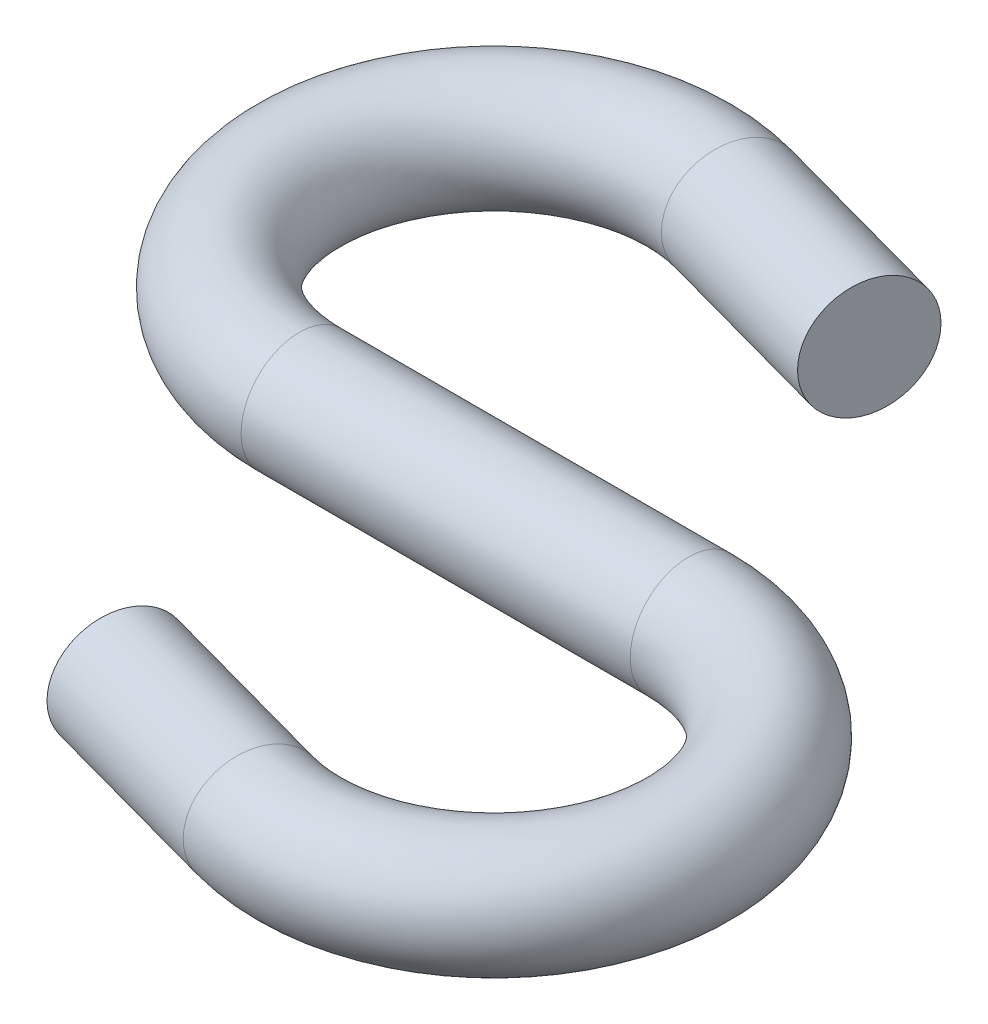
from build123d import *

# Parameters (mm, degrees)
SKETCH2_R         = 4.7625
CIRPATTERN1_COUNT = 2


with BuildPart() as part:
    # Sweep1: sweep along a path in Sketch1
    with BuildLine(Plane(origin=(0, 0, 0), x_dir=(1, 0, 0), z_dir=(0, 1, 0))) as sweep1_path:
        Line((0, 0), (-15.875, 0))
        ThreePointArc((-15.875, 0), (-31.608119304, 17.992683159), (-11.677486704, 31.185013296))
        Line((-11.677486704, 31.185013296), (3.632526592, 26.9875))
    # Sketch2 → Sweep1 (sweep)
    with BuildSketch(Plane(origin=(0, 0, 0), x_dir=(0, 0, -1), z_dir=(1, 0, 0))):
        Circle(SKETCH2_R)
    sweep1 = sweep(path=sweep1_path.line)

    # CirPattern1: Sweep1 ×2 about axis
    cirpattern1_axis = Axis((0, 55, 0), (0, -1, 0))
    for i in range(1, CIRPATTERN1_COUNT):
        add(sweep1.rotate(cirpattern1_axis, i * 360 / CIRPATTERN1_COUNT))


solid = part.part
